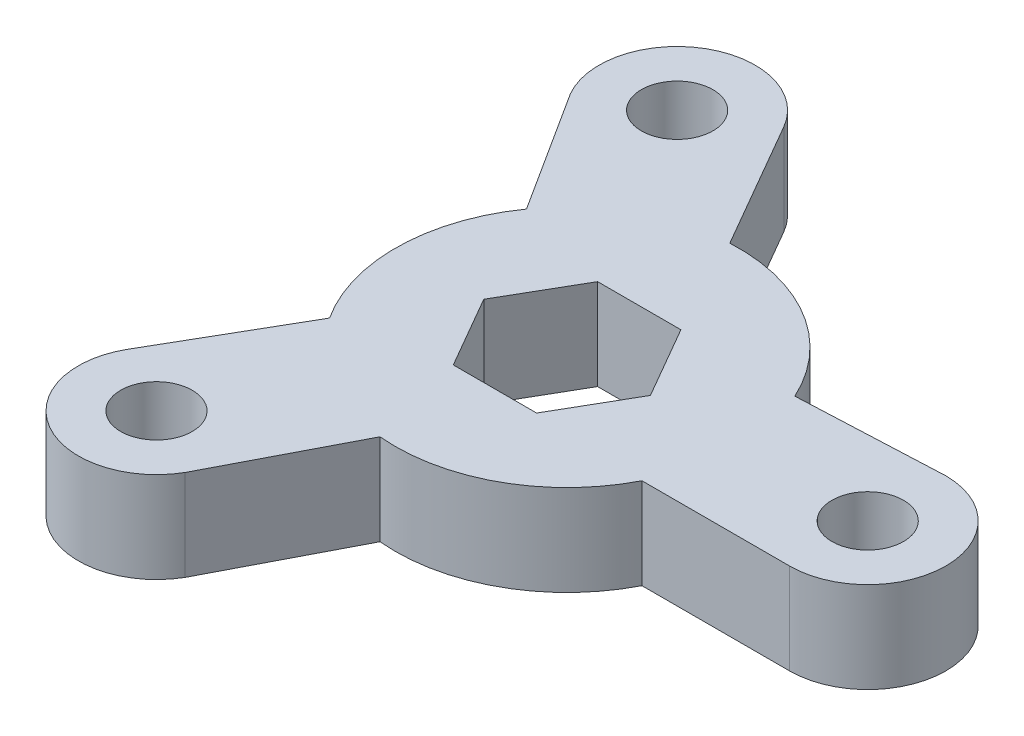
from build123d import *

# Parameters (mm, degrees)
SKETCH1_R           = 1.25
BOSS_EXTRUDE1_DEPTH = 3.175


with BuildPart() as part:
    # Sketch1 → Boss-Extrude1 (new body)
    with BuildSketch(Plane(origin=(0, 0, 0), x_dir=(1, 0, 0), z_dir=(0, 1, 0))):
        with BuildLine():
            Line((7.858300919, -2.484134681), (13.014762042, -2.484134681))
            ThreePointArc((13.014762042, -2.484134681), (15.743606535, 0.244709812), (13.014762042, 2.973554305))
            Line((13.014762042, 2.973554305), (7.969118099, 2.744709812))
            ThreePointArc((7.969118099, 2.744709812), (5.624188125, 5.376129638), (2.206241257, 6.236772472))
            Line((2.206241257, 6.236772472), (-0.371989304, 10.702398798))
            ThreePointArc((-0.371989304, 10.702398798), (-4.099660205, 11.701225206), (-5.098486612, 7.973554305))
            Line((-5.098486612, 7.973554305), (-2.377479496, 3.718320719))
            ThreePointArc((-2.377479496, 3.718320719), (-3.483890927, 0.371841879), (-2.520256051, -3.018508355))
            Line((-2.520256051, -3.018508355), (-5.098486612, -7.484134681))
            ThreePointArc((-5.098486612, -7.484134681), (-4.099660205, -11.211805582), (-0.371989304, -10.212979174))
            Line((-0.371989304, -10.212979174), (1.952647522, -5.728901095))
            ThreePointArc((1.952647522, -5.728901095), (5.403988927, -5.013842081), (7.858300919, -2.484134681))
        make_face()
        Polygon((3.96968472, 2.764709812), (5.424607398, 0.244709812), (3.96968472, -2.275290188), (1.059839363, -2.275290188), (-0.395083315, 0.244709812), (1.059839363, 2.764709812), align=None, mode=Mode.SUBTRACT)
        with Locations(Location((13.014762042, 0.244709812, 0), (0, 0, 270))):
            Circle(SKETCH1_R, mode=Mode.SUBTRACT)
        with Locations(Location((-2.735237958, 9.337976552, 0), (0, 0, 270))):
            Circle(SKETCH1_R, mode=Mode.SUBTRACT)
        with Locations(Location((-2.735237958, -8.848556928, 0), (0, 0, 270))):
            Circle(SKETCH1_R, mode=Mode.SUBTRACT)
    extrude(amount=BOSS_EXTRUDE1_DEPTH)


solid = part.part
